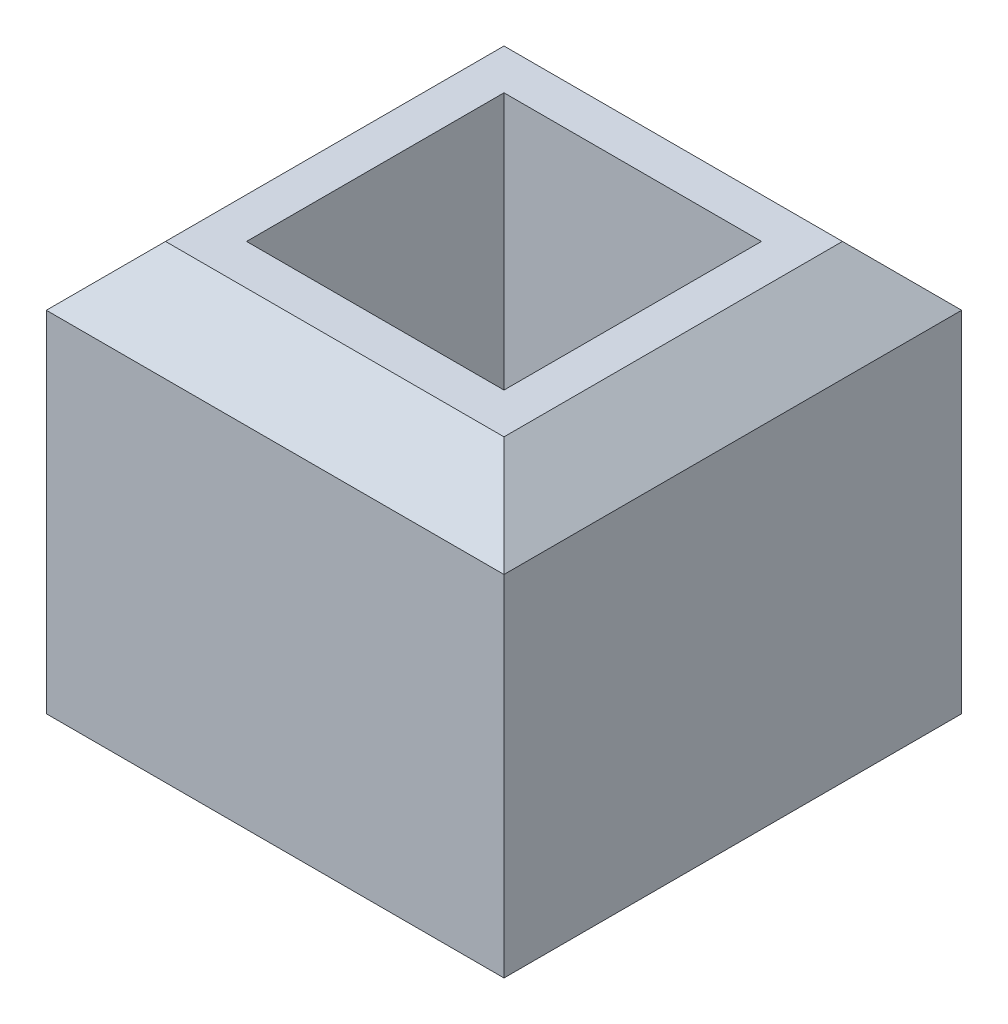
from build123d import *

# Parameters (mm, degrees)
SKETCH2_W           = 6.096
SKETCH2_H           = 6.096
SKETCH2_W_2         = 3.429
SKETCH2_H_2         = 3.429
BOSS_EXTRUDE1_DEPTH = 5.4483
CHAMFER1_SIZE       = 0.79375


with BuildPart() as part:
    # Sketch2 → Boss-Extrude1 (new body)
    with BuildSketch(Plane(origin=(0, 0, 0), x_dir=(1, 0, 0), z_dir=(0, 1, 0))):
        Rectangle(SKETCH2_W, SKETCH2_H)
        Rectangle(SKETCH2_W_2, SKETCH2_H_2, mode=Mode.SUBTRACT)
    extrude(amount=BOSS_EXTRUDE1_DEPTH)

    # Chamfer1
    chamfer1_edges = [part.edges().sort_by_distance(p)[0] for p in [
        (-3.048, 5.4483, 0),
        (0, 5.4483, 3.048),
        (3.048, 5.4483, 0),
        (0, 5.4483, -3.048),
    ]]
    chamfer(chamfer1_edges, length=CHAMFER1_SIZE)


solid = part.part
